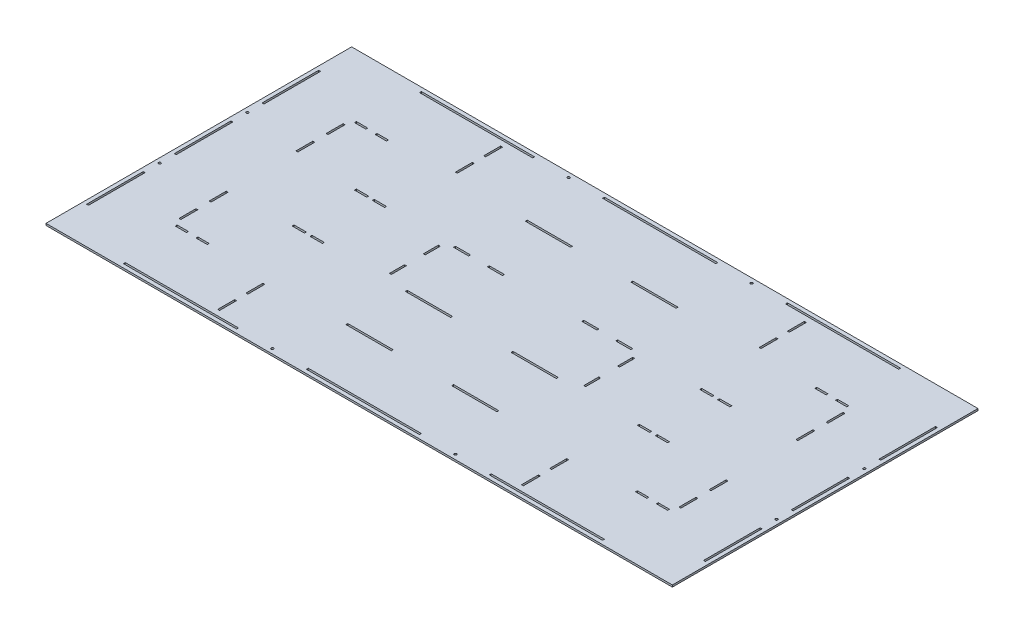
from build123d import *

# Parameters (mm, degrees)
CROQUIS1_W              = 1660
CROQUIS1_H              = 810
CROQUIS1_W_2            = 300
CROQUIS1_H_2            = 5
SALIENTE_EXTRUIR3_DEPTH = 5
CROQUIS2_W              = 5
CROQUIS2_H              = 40
CROQUIS2_W_2            = 30
CROQUIS2_H_2            = 5
CROQUIS2_W_3            = 120
CROQUIS2_W_4            = 32.5
CROQUIS2_H_3            = 45
CROQUIS2_W_5            = 40
CORTAR_EXTRUIR2_DEPTH   = 10
CROQUIS3_R              = 3.2
CORTAR_EXTRUIR3_DEPTH   = 10


with BuildPart() as part:
    # Croquis1 → Saliente-Extruir3 (new body)
    with BuildSketch(Plane(origin=(0, 0, 0), x_dir=(1, 0, 0), z_dir=(0, 1, 0))):
        with Locations((-1267.044657187, -398.10267676)):
            Rectangle(CROQUIS1_W, CROQUIS1_H)
        Polygon((-447.044657187, -95.60267676), (-447.044657187, -240.60267676), (-452.044657187, -240.60267676), (-452.044657187, -95.60267676), (-452.044657187, -90.60267676), (-447.044657187, -90.60267676), align=None, mode=Mode.SUBTRACT)
        with Locations((-782.044657187, -5.60267676)):
            Rectangle(CROQUIS1_W_2, CROQUIS1_H_2, mode=Mode.SUBTRACT)
        with Locations((-1267.044657187, -5.60267676)):
            Rectangle(CROQUIS1_W_2, CROQUIS1_H_2, mode=Mode.SUBTRACT)
        with Locations((-1752.044657187, -5.60267676)):
            Rectangle(CROQUIS1_W_2, CROQUIS1_H_2, mode=Mode.SUBTRACT)
        Polygon((-452.044657187, -328.10267676), (-452.044657187, -473.10267676), (-447.044657187, -473.10267676), (-447.044657187, -328.10267676), (-447.044657187, -323.10267676), (-452.044657187, -323.10267676), align=None, mode=Mode.SUBTRACT)
        Polygon((-452.044657187, -560.60267676), (-452.044657187, -705.60267676), (-447.044657187, -705.60267676), (-447.044657187, -560.60267676), (-447.044657187, -555.60267676), (-452.044657187, -555.60267676), align=None, mode=Mode.SUBTRACT)
        Polygon((-2087.044657187, -705.60267676), (-2082.044657187, -705.60267676), (-2082.044657187, -560.60267676), (-2082.044657187, -555.60267676), (-2087.044657187, -555.60267676), (-2087.044657187, -560.60267676), align=None, mode=Mode.SUBTRACT)
        Polygon((-2087.044657187, -473.10267676), (-2082.044657187, -473.10267676), (-2082.044657187, -328.10267676), (-2082.044657187, -323.10267676), (-2087.044657187, -323.10267676), (-2087.044657187, -328.10267676), align=None, mode=Mode.SUBTRACT)
        Polygon((-2087.044657187, -240.60267676), (-2082.044657187, -240.60267676), (-2082.044657187, -95.60267676), (-2082.044657187, -90.60267676), (-2087.044657187, -90.60267676), (-2087.044657187, -95.60267676), align=None, mode=Mode.SUBTRACT)
        with Locations((-1267.044657187, -790.60267676)):
            Rectangle(CROQUIS1_W_2, CROQUIS1_H_2, mode=Mode.SUBTRACT)
        with Locations((-782.044657187, -790.60267676)):
            Rectangle(CROQUIS1_W_2, CROQUIS1_H_2, mode=Mode.SUBTRACT)
        with Locations((-1752.044657187, -790.60267676)):
            Rectangle(CROQUIS1_W_2, CROQUIS1_H_2, mode=Mode.SUBTRACT)
    extrude(amount=SALIENTE_EXTRUIR3_DEPTH)

    # Croquis2 → Cortar-Extruir2 (cut)
    with BuildSketch(Plane(origin=(0, 5, 0), x_dir=(1, 0, 0), z_dir=(0, 1, 0))):
        with Locations((-1009.544657188, -443.10267676)):
            Rectangle(CROQUIS2_W, CROQUIS2_H)
        with Locations((-684.544657187, -635.60267676)):
            Rectangle(CROQUIS2_W_2, CROQUIS2_H_2)
        with Locations((-1127.044657187, -635.60267676)):
            Rectangle(CROQUIS2_W_3, CROQUIS2_H_2)
        with Locations((-1407.044657187, -635.60267676)):
            Rectangle(CROQUIS2_W_3, CROQUIS2_H_2)
        with Locations((-629.544657187, -635.60267676)):
            Rectangle(CROQUIS2_W_2, CROQUIS2_H_2)
        with Locations((-1404.544657188, -480.60267676)):
            Rectangle(CROQUIS2_W_3, CROQUIS2_H_2)
        with Locations((-785.794657187, -480.60267676)):
            Rectangle(CROQUIS2_W_4, CROQUIS2_H_2)
        with Locations((-833.294657187, -480.60267676)):
            Rectangle(CROQUIS2_W_4, CROQUIS2_H_2)
        with Locations((-604.544657187, -513.10267676)):
            Rectangle(CROQUIS2_W, CROQUIS2_H_3)
        with Locations((-864.544657187, -675.60267676)):
            Rectangle(CROQUIS2_W, CROQUIS2_H_3)
        with Locations((-1052.044657188, -315.60267676)):
            Rectangle(CROQUIS2_W_5, CROQUIS2_H_2)
        with Locations((-1142.044657188, -315.60267676)):
            Rectangle(CROQUIS2_W_5, CROQUIS2_H_2)
        with Locations((-1009.544657188, -353.10267676)):
            Rectangle(CROQUIS2_W, CROQUIS2_H)
        with Locations((-1124.544657188, -480.60267676)):
            Rectangle(CROQUIS2_W_3, CROQUIS2_H_2)
        with Locations((-604.544657187, -593.10267676)):
            Rectangle(CROQUIS2_W, CROQUIS2_H_3)
        with Locations((-1127.044657187, -160.60267676)):
            Rectangle(CROQUIS2_W_3, CROQUIS2_H_2)
        with Locations((-1407.044657187, -160.60267676)):
            Rectangle(CROQUIS2_W_3, CROQUIS2_H_2)
        with Locations((-864.544657187, -750.60267676)):
            Rectangle(CROQUIS2_W, CROQUIS2_H_3)
        with Locations((-1392.044657187, -315.60267676)):
            Rectangle(CROQUIS2_W_5, CROQUIS2_H_2)
        with Locations((-1929.544657187, -283.10267676)):
            Rectangle(CROQUIS2_W, CROQUIS2_H_3)
        with Locations((-1482.044657187, -315.60267676)):
            Rectangle(CROQUIS2_W_5, CROQUIS2_H_2)
        with Locations((-1700.794657187, -480.60267676)):
            Rectangle(CROQUIS2_W_4, CROQUIS2_H_2)
        with Locations((-1748.294657187, -480.60267676)):
            Rectangle(CROQUIS2_W_4, CROQUIS2_H_2)
        with Locations((-1929.544657187, -513.10267676)):
            Rectangle(CROQUIS2_W, CROQUIS2_H_3)
        with Locations((-1669.544657187, -750.60267676)):
            Rectangle(CROQUIS2_W, CROQUIS2_H_3)
        with Locations((-1524.544657187, -353.10267676)):
            Rectangle(CROQUIS2_W, CROQUIS2_H)
        with Locations((-1524.544657187, -443.10267676)):
            Rectangle(CROQUIS2_W, CROQUIS2_H)
        with Locations((-1669.544657187, -675.60267676)):
            Rectangle(CROQUIS2_W, CROQUIS2_H_3)
        with Locations((-1904.544657187, -635.60267676)):
            Rectangle(CROQUIS2_W_2, CROQUIS2_H_2)
        with Locations((-1929.544657187, -593.10267676)):
            Rectangle(CROQUIS2_W, CROQUIS2_H_3)
        with Locations((-1849.544657187, -635.60267676)):
            Rectangle(CROQUIS2_W_2, CROQUIS2_H_2)
        with Locations((-604.544657187, -283.10267676)):
            Rectangle(CROQUIS2_W, CROQUIS2_H_3)
        with Locations((-833.294657187, -315.60267676)):
            Rectangle(CROQUIS2_W_4, CROQUIS2_H_2)
        with Locations((-785.794657187, -315.60267676)):
            Rectangle(CROQUIS2_W_4, CROQUIS2_H_2)
        with Locations((-864.544657187, -45.60267676)):
            Rectangle(CROQUIS2_W, CROQUIS2_H_3)
        with Locations((-864.544657187, -120.60267676)):
            Rectangle(CROQUIS2_W, CROQUIS2_H_3)
        with Locations((-629.544657187, -160.60267676)):
            Rectangle(CROQUIS2_W_2, CROQUIS2_H_2)
        with Locations((-604.544657187, -203.10267676)):
            Rectangle(CROQUIS2_W, CROQUIS2_H_3)
        with Locations((-684.544657187, -160.60267676)):
            Rectangle(CROQUIS2_W_2, CROQUIS2_H_2)
        with Locations((-1849.544657187, -160.60267676)):
            Rectangle(CROQUIS2_W_2, CROQUIS2_H_2)
        with Locations((-1904.544657187, -160.60267676)):
            Rectangle(CROQUIS2_W_2, CROQUIS2_H_2)
        with Locations((-1669.544657187, -120.60267676)):
            Rectangle(CROQUIS2_W, CROQUIS2_H_3)
        with Locations((-1929.544657187, -203.10267676)):
            Rectangle(CROQUIS2_W, CROQUIS2_H_3)
        with Locations((-1669.544657187, -45.60267676)):
            Rectangle(CROQUIS2_W, CROQUIS2_H_3)
        with Locations((-1748.294657187, -315.60267676)):
            Rectangle(CROQUIS2_W_4, CROQUIS2_H_2)
        with Locations((-1700.794657187, -315.60267676)):
            Rectangle(CROQUIS2_W_4, CROQUIS2_H_2)
    extrude(amount=-CORTAR_EXTRUIR2_DEPTH, mode=Mode.SUBTRACT)

    # Croquis3 → Cortar-Extruir3 (cut)
    with BuildSketch(Plane(origin=(0, 5, 0), x_dir=(1, 0, 0), z_dir=(0, 1, 0))):
        with Locations(Location((-2084.544657187, -281.85267676, 0), (0, 0, 270))):
            Circle(CROQUIS3_R)
        with Locations(Location((-2084.544657187, -514.35267676, 0), (0, 0, 270))):
            Circle(CROQUIS3_R)
        with Locations(Location((-1509.544657187, -790.60267676, 0), (0, 0, 270))):
            Circle(CROQUIS3_R)
        with Locations(Location((-1024.544657187, -790.60267676, 0), (0, 0, 270))):
            Circle(CROQUIS3_R)
        with Locations(Location((-449.544657187, -514.35267676, 0), (0, 0, 270))):
            Circle(CROQUIS3_R)
        with Locations(Location((-449.544657187, -281.85267676, 0), (0, 0, 270))):
            Circle(CROQUIS3_R)
        with Locations(Location((-1024.544657187, -5.60267676, 0), (0, 0, 270))):
            Circle(CROQUIS3_R)
        with Locations(Location((-1509.544657187, -5.60267676, 0), (0, 0, 270))):
            Circle(CROQUIS3_R)
    extrude(amount=-CORTAR_EXTRUIR3_DEPTH, mode=Mode.SUBTRACT)


solid = part.part
